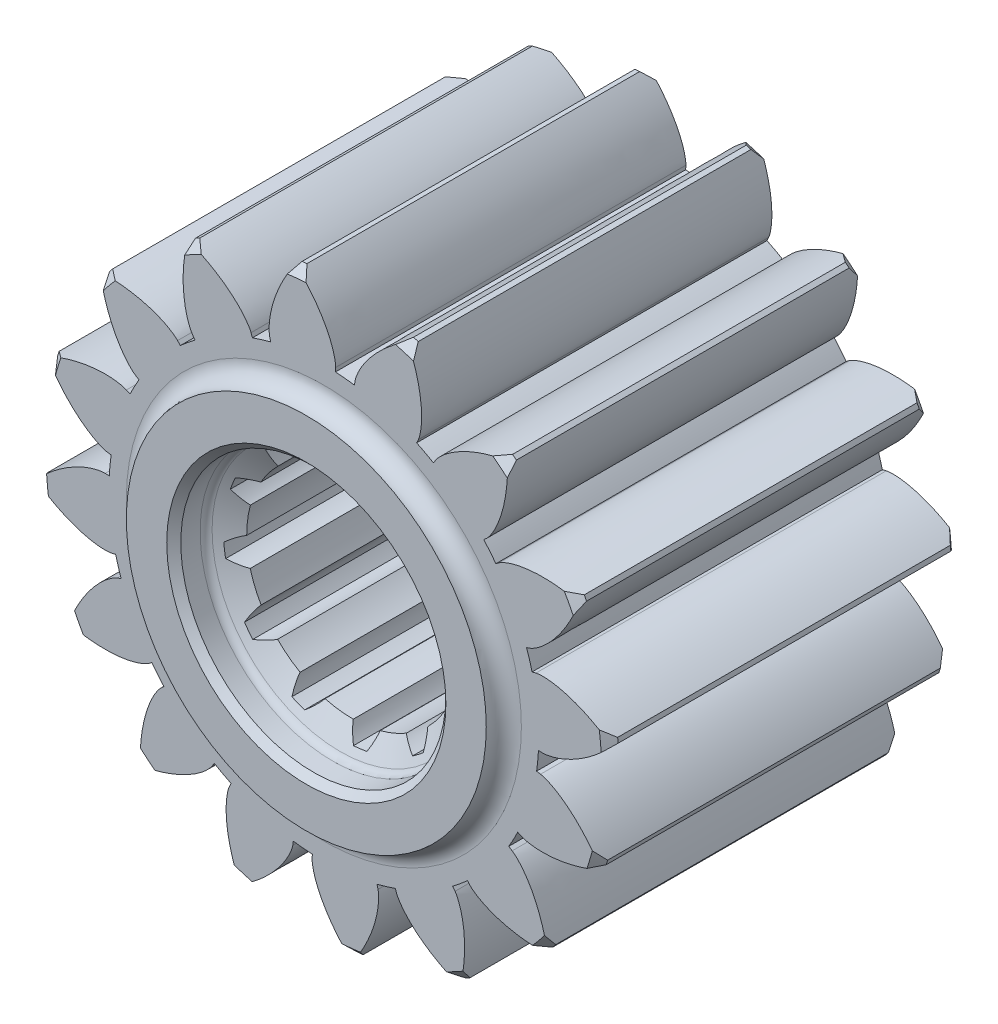
from build123d import *

# Parameters (mm, degrees)
CUT_EXTRUDE1_DEPTH = 64.71228296
CUT_EXTRUDE2_DEPTH = 64.71228296


with BuildPart() as part:
    # Sketch1 → Revolve1 (revolve)
    with BuildSketch(Plane(origin=(0, 0, 0), x_dir=(0, 0, -1), z_dir=(1, 0, 0)), mode=Mode.PRIVATE) as revolve1_sk:
        with BuildLine():
            Line((0, 15.9), (0, 20.5))
            ThreePointArc((0, 20.5), (1.414213562, 21.085786438), (2, 22.5))
            Line((2, 22.5), (2, 31.65))
            Line((2, 31.65), (3, 32.65))
            Line((3, 32.65), (40.9, 32.65))
            Line((40.9, 32.65), (41.9, 31.65))
            Line((41.9, 31.65), (41.9, 22.5))
            ThreePointArc((41.9, 22.5), (42.485786438, 21.085786438), (43.9, 20.5))
            Line((43.9, 20.5), (43.9, 15.9))
            Line((43.9, 15.9), (43.1, 15.1))
            Line((43.1, 15.1), (40.9, 15.1))
            ThreePointArc((40.9, 15.1), (40.4, 14.966025404), (40.033974596, 14.6))
            Line((40.033974596, 14.6), (38.590598923, 12.1))
            Line((38.590598923, 12.1), (5.309401077, 12.1))
            Line((5.309401077, 12.1), (3.866025404, 14.6))
            ThreePointArc((3.866025404, 14.6), (3.5, 14.966025404), (3, 15.1))
            Line((3, 15.1), (0.8, 15.1))
            Line((0.8, 15.1), (0, 15.9))
        make_face()
    revolve(revolve1_sk.sketch.rotate(Axis((0, 0, 0), (0, 0, -1)), 90), axis=Axis((0, 0, 0), (0, 0, -1)))

    # Sketch2 → Cut-Extrude1 (cut, through all)
    with BuildSketch(Plane.XY):
        with BuildLine():
            add(Edge.make_bspline(
                [(-6, 10.392304845), (-6.083308328, 10.463331779), (-6.269176039, 10.613754424), (-6.594236465, 10.826695887), (-6.98399774, 11.047629995), (-7.379208652, 11.234273746), (-7.646059201, 11.341671616), (-7.756770639, 11.3834588)],
                knots=[0.250164539, 0.250164539, 0.250164539, 0.250164539, 0.360157942, 0.490164615, 0.640140514, 0.810085642, 0.928974744, 0.928974744, 0.928974744, 0.928974744], degree=3))
            ThreePointArc((-7.756770639, 11.3834588), (-8.384963449, 10.928998717), (-8.98659136, 10.439913828))
            add(Edge.make_bspline(
                [(-8.484155123, 8.486407476), (-8.531186971, 8.585266508), (-8.628348989, 8.803746073), (-8.74985383, 9.172859769), (-8.862324593, 9.606537136), (-8.940263424, 10.036598869), (-8.974897897, 10.322157919), (-8.98659136, 10.439913828)],
                knots=[0.250164539, 0.250164539, 0.250164539, 0.250164539, 0.360157942, 0.490164615, 0.640140514, 0.810085642, 0.928974744, 0.928974744, 0.928974744, 0.928974744], degree=3))
            ThreePointArc((-8.484155123, 8.486407476), (-7.304505363, 9.520724836), (-6, 10.392304845))
        make_face()
        with BuildLine():
            add(Edge.make_bspline(
                [(-10.392304845, 6), (-10.499965441, 6.019856965), (-10.736142923, 6.057192941), (-11.124124241, 6.079075445), (-11.57213446, 6.075529357), (-12.007719026, 6.039562131), (-12.292517315, 5.99914614), (-12.409289825, 5.979979185)],
                knots=[0.250164539, 0.250164539, 0.250164539, 0.250164539, 0.360157942, 0.490164615, 0.640140514, 0.810085642, 0.928974744, 0.928974744, 0.928974744, 0.928974744], degree=3))
            ThreePointArc((-12.409289825, 5.979979185), (-12.726090715, 5.272308803), (-13.002573325, 4.547934908))
            add(Edge.make_bspline(
                [(-11.590697604, 3.107366899), (-11.680857895, 3.169465408), (-11.874242454, 3.310093253), (-12.164025581, 3.56900267), (-12.478266802, 3.888342906), (-12.760794676, 4.221817876), (-12.933568534, 4.451802031), (-13.002573325, 4.547934908)],
                knots=[0.250164539, 0.250164539, 0.250164539, 0.250164539, 0.360157942, 0.490164615, 0.640140514, 0.810085642, 0.928974744, 0.928974744, 0.928974744, 0.928974744], degree=3))
            ThreePointArc((-11.590697604, 3.107366899), (-11.086249625, 4.592936888), (-10.392304845, 6))
        make_face()
        with BuildLine():
            ThreePointArc((-13.736749823, -1.025831024), (-13.657272252, -1.797091997), (-13.534526268, -2.562659497))
            add(Edge.make_bspline(
                [(-11.591522022, -3.104290129), (-11.700652379, -3.095591387), (-11.938442242, -3.070496381), (-12.3188565, -2.991165812), (-12.750667499, -2.871729666), (-13.1620813, -2.724195808), (-13.426699928, -2.611410616), (-13.534526268, -2.562659497)],
                knots=[0.250164539, 0.250164539, 0.250164539, 0.250164539, 0.360157942, 0.490164615, 0.640140514, 0.810085642, 0.928974744, 0.928974744, 0.928974744, 0.928974744], degree=3))
            ThreePointArc((-11.591522022, -3.104290129), (-11.897442252, -1.565524789), (-12, 0))
            add(Edge.make_bspline(
                [(-12, 0), (-12.103165293, -0.036633662), (-12.326368981, -0.122388499), (-12.67331191, -0.297428354), (-13.059527097, -0.524504465), (-13.418770784, -0.77344528), (-13.645205342, -0.950845699), (-13.736749823, -1.025831024)],
                knots=[0.250164539, 0.250164539, 0.250164539, 0.250164539, 0.360157942, 0.490164615, 0.640140514, 0.810085642, 0.928974744, 0.928974744, 0.928974744, 0.928974744], degree=3))
        make_face()
        with BuildLine():
            ThreePointArc((-11.3834588, -7.756770639), (-10.928998717, -8.384963449), (-10.439913828, -8.98659136))
            add(Edge.make_bspline(
                [(-8.486407476, -8.484155123), (-8.585266508, -8.531186971), (-8.803746073, -8.628348989), (-9.172859769, -8.74985383), (-9.606537136, -8.862324593), (-10.036598869, -8.940263424), (-10.322157919, -8.974897897), (-10.439913828, -8.98659136)],
                knots=[0.250164539, 0.250164539, 0.250164539, 0.250164539, 0.360157942, 0.490164615, 0.640140514, 0.810085642, 0.928974744, 0.928974744, 0.928974744, 0.928974744], degree=3))
            ThreePointArc((-8.486407476, -8.484155123), (-9.520724836, -7.304505363), (-10.392304845, -6))
            add(Edge.make_bspline(
                [(-10.392304845, -6), (-10.463331779, -6.083308328), (-10.613754424, -6.269176039), (-10.826695887, -6.594236465), (-11.047629995, -6.98399774), (-11.234273746, -7.379208652), (-11.341671616, -7.646059201), (-11.3834588, -7.756770639)],
                knots=[0.250164539, 0.250164539, 0.250164539, 0.250164539, 0.360157942, 0.490164615, 0.640140514, 0.810085642, 0.928974744, 0.928974744, 0.928974744, 0.928974744], degree=3))
        make_face()
        with BuildLine():
            ThreePointArc((-5.979979185, -12.409289825), (-5.272308803, -12.726090715), (-4.547934908, -13.002573325))
            add(Edge.make_bspline(
                [(-3.107366899, -11.590697604), (-3.169465408, -11.680857895), (-3.310093253, -11.874242454), (-3.56900267, -12.164025581), (-3.888342906, -12.478266802), (-4.221817876, -12.760794676), (-4.451802031, -12.933568534), (-4.547934908, -13.002573325)],
                knots=[0.250164539, 0.250164539, 0.250164539, 0.250164539, 0.360157942, 0.490164615, 0.640140514, 0.810085642, 0.928974744, 0.928974744, 0.928974744, 0.928974744], degree=3))
            ThreePointArc((-3.107366899, -11.590697604), (-4.592936888, -11.086249625), (-6, -10.392304845))
            add(Edge.make_bspline(
                [(-6, -10.392304845), (-6.019856965, -10.499965441), (-6.057192941, -10.736142923), (-6.079075445, -11.124124241), (-6.075529357, -11.57213446), (-6.039562131, -12.007719026), (-5.99914614, -12.292517315), (-5.979979185, -12.409289825)],
                knots=[0.250164539, 0.250164539, 0.250164539, 0.250164539, 0.360157942, 0.490164615, 0.640140514, 0.810085642, 0.928974744, 0.928974744, 0.928974744, 0.928974744], degree=3))
        make_face()
        with BuildLine():
            ThreePointArc((1.025831024, -13.736749823), (1.797091997, -13.657272252), (2.562659497, -13.534526268))
            add(Edge.make_bspline(
                [(3.104290129, -11.591522022), (3.095591387, -11.700652379), (3.070496381, -11.938442242), (2.991165812, -12.3188565), (2.871729666, -12.750667499), (2.724195808, -13.1620813), (2.611410616, -13.426699928), (2.562659497, -13.534526268)],
                knots=[0.250164539, 0.250164539, 0.250164539, 0.250164539, 0.360157942, 0.490164615, 0.640140514, 0.810085642, 0.928974744, 0.928974744, 0.928974744, 0.928974744], degree=3))
            ThreePointArc((3.104290129, -11.591522022), (1.565524789, -11.897442252), (0, -12))
            add(Edge.make_bspline(
                [(0, -12), (0.036633662, -12.103165293), (0.122388499, -12.326368981), (0.297428354, -12.67331191), (0.524504465, -13.059527097), (0.77344528, -13.418770784), (0.950845699, -13.645205342), (1.025831024, -13.736749823)],
                knots=[0.250164539, 0.250164539, 0.250164539, 0.250164539, 0.360157942, 0.490164615, 0.640140514, 0.810085642, 0.928974744, 0.928974744, 0.928974744, 0.928974744], degree=3))
        make_face()
        with BuildLine():
            ThreePointArc((7.756770639, -11.3834588), (8.384963449, -10.928998717), (8.98659136, -10.439913828))
            add(Edge.make_bspline(
                [(8.484155123, -8.486407476), (8.531186971, -8.585266508), (8.628348989, -8.803746073), (8.74985383, -9.172859769), (8.862324593, -9.606537136), (8.940263424, -10.036598869), (8.974897897, -10.322157919), (8.98659136, -10.439913828)],
                knots=[0.250164539, 0.250164539, 0.250164539, 0.250164539, 0.360157942, 0.490164615, 0.640140514, 0.810085642, 0.928974744, 0.928974744, 0.928974744, 0.928974744], degree=3))
            ThreePointArc((8.484155123, -8.486407476), (7.304505363, -9.520724836), (6, -10.392304845))
            add(Edge.make_bspline(
                [(6, -10.392304845), (6.083308328, -10.463331779), (6.269176039, -10.613754424), (6.594236465, -10.826695887), (6.98399774, -11.047629995), (7.379208652, -11.234273746), (7.646059201, -11.341671616), (7.756770639, -11.3834588)],
                knots=[0.250164539, 0.250164539, 0.250164539, 0.250164539, 0.360157942, 0.490164615, 0.640140514, 0.810085642, 0.928974744, 0.928974744, 0.928974744, 0.928974744], degree=3))
        make_face()
        with BuildLine():
            ThreePointArc((12.409289825, -5.979979185), (12.726090715, -5.272308803), (13.002573325, -4.547934908))
            add(Edge.make_bspline(
                [(11.590697604, -3.107366899), (11.680857895, -3.169465408), (11.874242454, -3.310093253), (12.164025581, -3.56900267), (12.478266802, -3.888342906), (12.760794676, -4.221817876), (12.933568534, -4.451802031), (13.002573325, -4.547934908)],
                knots=[0.250164539, 0.250164539, 0.250164539, 0.250164539, 0.360157942, 0.490164615, 0.640140514, 0.810085642, 0.928974744, 0.928974744, 0.928974744, 0.928974744], degree=3))
            ThreePointArc((11.590697604, -3.107366899), (11.086249625, -4.592936888), (10.392304845, -6))
            add(Edge.make_bspline(
                [(10.392304845, -6), (10.499965441, -6.019856965), (10.736142923, -6.057192941), (11.124124241, -6.079075445), (11.57213446, -6.075529357), (12.007719026, -6.039562131), (12.292517315, -5.99914614), (12.409289825, -5.979979185)],
                knots=[0.250164539, 0.250164539, 0.250164539, 0.250164539, 0.360157942, 0.490164615, 0.640140514, 0.810085642, 0.928974744, 0.928974744, 0.928974744, 0.928974744], degree=3))
        make_face()
        with BuildLine():
            add(Edge.make_bspline(
                [(12, 0), (12.103165293, 0.036633662), (12.326368981, 0.122388499), (12.67331191, 0.297428354), (13.059527097, 0.524504465), (13.418770784, 0.77344528), (13.645205342, 0.950845699), (13.736749823, 1.025831024)],
                knots=[0.250164539, 0.250164539, 0.250164539, 0.250164539, 0.360157942, 0.490164615, 0.640140514, 0.810085642, 0.928974744, 0.928974744, 0.928974744, 0.928974744], degree=3))
            ThreePointArc((13.736749823, 1.025831024), (13.657272252, 1.797091997), (13.534526268, 2.562659497))
            add(Edge.make_bspline(
                [(11.591522022, 3.104290129), (11.700652379, 3.095591387), (11.938442242, 3.070496381), (12.3188565, 2.991165812), (12.750667499, 2.871729666), (13.1620813, 2.724195808), (13.426699928, 2.611410616), (13.534526268, 2.562659497)],
                knots=[0.250164539, 0.250164539, 0.250164539, 0.250164539, 0.360157942, 0.490164615, 0.640140514, 0.810085642, 0.928974744, 0.928974744, 0.928974744, 0.928974744], degree=3))
            ThreePointArc((11.591522022, 3.104290129), (11.897442252, 1.565524789), (12, 0))
        make_face()
        with BuildLine():
            add(Edge.make_bspline(
                [(10.392304845, 6), (10.463331779, 6.083308328), (10.613754424, 6.269176039), (10.826695887, 6.594236465), (11.047629995, 6.98399774), (11.234273746, 7.379208652), (11.341671616, 7.646059201), (11.3834588, 7.756770639)],
                knots=[0.250164539, 0.250164539, 0.250164539, 0.250164539, 0.360157942, 0.490164615, 0.640140514, 0.810085642, 0.928974744, 0.928974744, 0.928974744, 0.928974744], degree=3))
            ThreePointArc((11.3834588, 7.756770639), (10.928998717, 8.384963449), (10.439913828, 8.98659136))
            add(Edge.make_bspline(
                [(8.486407476, 8.484155123), (8.585266508, 8.531186971), (8.803746073, 8.628348989), (9.172859769, 8.74985383), (9.606537136, 8.862324593), (10.036598869, 8.940263424), (10.322157919, 8.974897897), (10.439913828, 8.98659136)],
                knots=[0.250164539, 0.250164539, 0.250164539, 0.250164539, 0.360157942, 0.490164615, 0.640140514, 0.810085642, 0.928974744, 0.928974744, 0.928974744, 0.928974744], degree=3))
            ThreePointArc((8.486407476, 8.484155123), (9.520724836, 7.304505363), (10.392304845, 6))
        make_face()
        with BuildLine():
            add(Edge.make_bspline(
                [(6, 10.392304845), (6.019856965, 10.499965441), (6.057192941, 10.736142923), (6.079075445, 11.124124241), (6.075529357, 11.57213446), (6.039562131, 12.007719026), (5.99914614, 12.292517315), (5.979979185, 12.409289825)],
                knots=[0.250164539, 0.250164539, 0.250164539, 0.250164539, 0.360157942, 0.490164615, 0.640140514, 0.810085642, 0.928974744, 0.928974744, 0.928974744, 0.928974744], degree=3))
            ThreePointArc((5.979979185, 12.409289825), (5.272308803, 12.726090715), (4.547934908, 13.002573325))
            add(Edge.make_bspline(
                [(3.107366899, 11.590697604), (3.169465408, 11.680857895), (3.310093253, 11.874242454), (3.56900267, 12.164025581), (3.888342906, 12.478266802), (4.221817876, 12.760794676), (4.451802031, 12.933568534), (4.547934908, 13.002573325)],
                knots=[0.250164539, 0.250164539, 0.250164539, 0.250164539, 0.360157942, 0.490164615, 0.640140514, 0.810085642, 0.928974744, 0.928974744, 0.928974744, 0.928974744], degree=3))
            ThreePointArc((3.107366899, 11.590697604), (4.592936888, 11.086249625), (6, 10.392304845))
        make_face()
        with BuildLine():
            add(Edge.make_bspline(
                [(0, 12), (-0.036633662, 12.103165293), (-0.122388499, 12.326368981), (-0.297428354, 12.67331191), (-0.524504465, 13.059527097), (-0.77344528, 13.418770784), (-0.950845699, 13.645205342), (-1.025831024, 13.736749823)],
                knots=[0.250164539, 0.250164539, 0.250164539, 0.250164539, 0.360157942, 0.490164615, 0.640140514, 0.810085642, 0.928974744, 0.928974744, 0.928974744, 0.928974744], degree=3))
            ThreePointArc((-1.025831024, 13.736749823), (-1.797091997, 13.657272252), (-2.562659497, 13.534526268))
            add(Edge.make_bspline(
                [(-3.104290129, 11.591522022), (-3.095591387, 11.700652379), (-3.070496381, 11.938442242), (-2.991165812, 12.3188565), (-2.871729666, 12.750667499), (-2.724195808, 13.1620813), (-2.611410616, 13.426699928), (-2.562659497, 13.534526268)],
                knots=[0.250164539, 0.250164539, 0.250164539, 0.250164539, 0.360157942, 0.490164615, 0.640140514, 0.810085642, 0.928974744, 0.928974744, 0.928974744, 0.928974744], degree=3))
            ThreePointArc((-3.104290129, 11.591522022), (-1.565524789, 11.897442252), (0, 12))
        make_face()
    extrude(amount=-CUT_EXTRUDE1_DEPTH, mode=Mode.SUBTRACT)

    # Sketch5 → Cut-Extrude2 (cut, through all)
    with BuildSketch(Plane.XY):
        with BuildLine():
            Line((1.339999101, 24.905509479), (1.31520303, 24.444644423))
            ThreePointArc((1.31520303, 24.444644423), (2.400672105, 24.362002657), (3.481393789, 24.231184397))
            Line((3.481393789, 24.231184397), (3.547029955, 24.688025002))
            add(Edge.make_bspline(
                [(3.547029955, 24.688025002), (3.588191523, 24.90604716), (3.748651512, 25.380269208), (4.127077833, 26.183224485), (4.742029159, 27.174027421), (5.670941576, 28.350245), (6.963369279, 29.648823759), (8.201436826, 30.636066291), (9.002466904, 31.185498674), (9.211702648, 31.323585911)],
                knots=[0, 0, 0, 0, 0.040002312, 0.090002485, 0.160002473, 0.250002323, 0.360002057, 0.490001686, 0.535233344, 0.535233344, 0.535233344, 0.535233344], degree=3))
            ThreePointArc((9.211702648, 31.323585911), (3.201876771, 32.492622011), (-2.920537009, 32.519116894))
            add(Edge.make_bspline(
                [(1.339999101, 24.905509479), (1.342184538, 25.127372409), (1.277373288, 25.623793059), (1.062952868, 26.485168436), (0.653222397, 27.576945213), (-0.028239685, 28.911851767), (-1.042341735, 30.437719771), (-2.063898237, 31.647629479), (-2.742278678, 32.342845352), (-2.920537009, 32.519116894)],
                knots=[0, 0, 0, 0, 0.040002312, 0.090002485, 0.160002473, 0.250002323, 0.360002057, 0.490001686, 0.535233348, 0.535233348, 0.535233348, 0.535233348], degree=3))
        make_face()
        with BuildLine():
            ThreePointArc((-8.13947127, 23.087213072), (-7.105002973, 23.426253067), (-6.056484349, 23.718967038))
            Line((-6.056484349, 23.718967038), (-6.170669769, 24.166150595))
            add(Edge.make_bspline(
                [(-6.170669769, 24.166150595), (-6.216074907, 24.383328655), (-6.249306128, 24.882858078), (-6.206963477, 25.769509508), (-6.017986402, 26.920223745), (-5.609902213, 28.362386484), (-4.912799287, 30.056707491), (-4.146775381, 31.442588598), (-3.616978758, 32.256738871), (-3.476513835, 32.464385895)],
                knots=[0, 0, 0, 0, 0.040002312, 0.090002485, 0.160002473, 0.250002323, 0.360002057, 0.490001686, 0.535233344, 0.535233344, 0.535233344, 0.535233344], degree=3))
            ThreePointArc((-3.476513835, 32.464385895), (-9.476239704, 31.244573626), (-15.142751638, 28.926105387))
            add(Edge.make_bspline(
                [(-8.29292811, 23.52248591), (-8.375812296, 23.728296861), (-8.625662041, 24.162127547), (-9.153394766, 24.875879485), (-9.949741246, 25.72775264), (-11.090176737, 26.700261235), (-12.611009271, 27.7218994), (-14.017816814, 28.448777466), (-14.910606215, 28.831468227), (-15.142751638, 28.926105387)],
                knots=[0, 0, 0, 0, 0.040002312, 0.090002485, 0.160002473, 0.250002323, 0.360002057, 0.490001686, 0.535233348, 0.535233348, 0.535233348, 0.535233348], degree=3))
            Line((-8.29292811, 23.52248591), (-8.13947127, 23.087213072))
        make_face()
        with BuildLine():
            ThreePointArc((-16.354984854, 18.214962817), (-15.529005757, 18.924068807), (-14.672317647, 19.59575196))
            Line((-14.672317647, 19.59575196), (-14.948940959, 19.965198827))
            add(Edge.make_bspline(
                [(-14.948940959, 19.965198827), (-15.074000281, 20.148469397), (-15.295863561, 20.59725737), (-15.596050865, 21.432620309), (-15.861818086, 22.568060037), (-16.036689244, 24.056611731), (-16.041038697, 25.888729972), (-15.863678628, 27.462261819), (-15.685772192, 28.417182983), (-15.6354626, 28.662777417)],
                knots=[0, 0, 0, 0, 0.040002312, 0.090002485, 0.160002473, 0.250002323, 0.360002057, 0.490001686, 0.535233344, 0.535233344, 0.535233344, 0.535233344], degree=3))
            ThreePointArc((-15.6354626, 28.662777417), (-20.711684585, 25.23982214), (-25.059619598, 20.92935655))
            add(Edge.make_bspline(
                [(-16.663332191, 18.558377092), (-16.818667635, 18.716803212), (-17.215518517, 19.021997146), (-17.976221021, 19.479463383), (-19.037946978, 19.961742951), (-20.463734914, 20.423797968), (-22.259764964, 20.785671145), (-23.837649852, 20.918856974), (-24.80892912, 20.930761422), (-25.059619598, 20.92935655)],
                knots=[0, 0, 0, 0, 0.040002312, 0.090002485, 0.160002473, 0.250002323, 0.360002057, 0.490001686, 0.535233348, 0.535233348, 0.535233348, 0.535233348], degree=3))
            Line((-16.663332191, 18.558377092), (-16.354984854, 18.214962817))
        make_face()
        with BuildLine():
            ThreePointArc((-22.080600252, 10.569649592), (-21.588858184, 11.540866618), (-21.054423588, 12.489261282))
            Line((-21.054423588, 12.489261282), (-21.451371399, 12.724726523))
            add(Edge.make_bspline(
                [(-21.451371399, 12.724726523), (-21.637045759, 12.846188321), (-22.013764423, 13.175910942), (-22.610780886, 13.832808956), (-23.290831755, 14.780113767), (-24.02203571, 16.088435917), (-24.727175378, 17.779427996), (-25.165480608, 19.301054623), (-25.366549002, 20.251368588), (-25.414053921, 20.497520906)],
                knots=[0, 0, 0, 0, 0.040002312, 0.090002485, 0.160002473, 0.250002323, 0.360002057, 0.490001686, 0.535233344, 0.535233344, 0.535233344, 0.535233344], degree=3))
            ThreePointArc((-25.414053921, 20.497520906), (-28.793963241, 15.392536532), (-31.161387641, 9.746302904))
            add(Edge.make_bspline(
                [(-22.496894999, 10.768923595), (-22.701033289, 10.855845943), (-23.184468358, 10.985940114), (-24.062330582, 11.117475562), (-25.227797863, 11.156738851), (-26.721874954, 11.037996603), (-28.519673226, 10.68501288), (-30.02841679, 10.204230137), (-30.930317461, 9.843535929), (-31.161387641, 9.746302904)],
                knots=[0, 0, 0, 0, 0.040002312, 0.090002485, 0.160002473, 0.250002323, 0.360002057, 0.490001686, 0.535233348, 0.535233348, 0.535233348, 0.535233348], degree=3))
            Line((-22.496894999, 10.768923595), (-22.080600252, 10.569649592))
        make_face()
        with BuildLine():
            ThreePointArc((-24.444644423, 1.31520303), (-24.362002657, 2.400672105), (-24.231184397, 3.481393789))
            Line((-24.231184397, 3.481393789), (-24.688025002, 3.547029955))
            add(Edge.make_bspline(
                [(-24.688025002, 3.547029955), (-24.90604716, 3.588191523), (-25.380269208, 3.748651512), (-26.183224485, 4.127077833), (-27.174027421, 4.742029159), (-28.350245, 5.670941576), (-29.648823759, 6.963369279), (-30.636066291, 8.201436826), (-31.185498674, 9.002466904), (-31.323585911, 9.211702648)],
                knots=[0, 0, 0, 0, 0.040002312, 0.090002485, 0.160002473, 0.250002323, 0.360002057, 0.490001686, 0.535233344, 0.535233344, 0.535233344, 0.535233344], degree=3))
            ThreePointArc((-31.323585911, 9.211702648), (-32.492622011, 3.201876771), (-32.519116894, -2.920537009))
            add(Edge.make_bspline(
                [(-24.905509479, 1.339999101), (-25.127372409, 1.342184538), (-25.623793059, 1.277373288), (-26.485168436, 1.062952868), (-27.576945213, 0.653222397), (-28.911851767, -0.028239685), (-30.437719771, -1.042341735), (-31.647629479, -2.063898237), (-32.342845352, -2.742278678), (-32.519116894, -2.920537009)],
                knots=[0, 0, 0, 0, 0.040002312, 0.090002485, 0.160002473, 0.250002323, 0.360002057, 0.490001686, 0.535233348, 0.535233348, 0.535233348, 0.535233348], degree=3))
            Line((-24.905509479, 1.339999101), (-24.444644423, 1.31520303))
        make_face()
        with BuildLine():
            ThreePointArc((-23.087213072, -8.13947127), (-23.426253067, -7.105002973), (-23.718967038, -6.056484349))
            Line((-23.718967038, -6.056484349), (-24.166150595, -6.170669769))
            add(Edge.make_bspline(
                [(-24.166150595, -6.170669769), (-24.383328655, -6.216074907), (-24.882858078, -6.249306128), (-25.769509508, -6.206963477), (-26.920223745, -6.017986402), (-28.362386484, -5.609902213), (-30.056707491, -4.912799287), (-31.442588598, -4.146775381), (-32.256738871, -3.616978758), (-32.464385895, -3.476513835)],
                knots=[0, 0, 0, 0, 0.040002312, 0.090002485, 0.160002473, 0.250002323, 0.360002057, 0.490001686, 0.535233344, 0.535233344, 0.535233344, 0.535233344], degree=3))
            ThreePointArc((-32.464385895, -3.476513835), (-31.244573626, -9.476239704), (-28.926105387, -15.142751638))
            add(Edge.make_bspline(
                [(-23.52248591, -8.29292811), (-23.728296861, -8.375812296), (-24.162127547, -8.625662041), (-24.875879485, -9.153394766), (-25.72775264, -9.949741246), (-26.700261235, -11.090176737), (-27.7218994, -12.611009271), (-28.448777466, -14.017816814), (-28.831468227, -14.910606215), (-28.926105387, -15.142751638)],
                knots=[0, 0, 0, 0, 0.040002312, 0.090002485, 0.160002473, 0.250002323, 0.360002057, 0.490001686, 0.535233348, 0.535233348, 0.535233348, 0.535233348], degree=3))
            Line((-23.52248591, -8.29292811), (-23.087213072, -8.13947127))
        make_face()
        with BuildLine():
            ThreePointArc((-18.214962817, -16.354984854), (-18.924068807, -15.529005757), (-19.59575196, -14.672317647))
            Line((-19.59575196, -14.672317647), (-19.965198827, -14.948940959))
            add(Edge.make_bspline(
                [(-19.965198827, -14.948940959), (-20.148469397, -15.074000281), (-20.59725737, -15.295863561), (-21.43262031, -15.596050864), (-22.568060037, -15.861818086), (-24.056611731, -16.036689244), (-25.888729972, -16.041038697), (-27.462261819, -15.863678628), (-28.417182983, -15.685772192), (-28.662777417, -15.6354626)],
                knots=[0, 0, 0, 0, 0.040002312, 0.090002485, 0.160002473, 0.250002323, 0.360002057, 0.490001686, 0.535233344, 0.535233344, 0.535233344, 0.535233344], degree=3))
            ThreePointArc((-28.662777417, -15.6354626), (-25.23982214, -20.711684585), (-20.92935655, -25.059619598))
            add(Edge.make_bspline(
                [(-18.558377092, -16.663332191), (-18.716803212, -16.818667635), (-19.021997146, -17.215518517), (-19.479463383, -17.976221021), (-19.961742951, -19.037946978), (-20.423797968, -20.463734914), (-20.785671145, -22.259764964), (-20.918856974, -23.837649852), (-20.930761422, -24.80892912), (-20.92935655, -25.059619598)],
                knots=[0, 0, 0, 0, 0.040002312, 0.090002485, 0.160002473, 0.250002323, 0.360002057, 0.490001686, 0.535233348, 0.535233348, 0.535233348, 0.535233348], degree=3))
            Line((-18.558377092, -16.663332191), (-18.214962817, -16.354984854))
        make_face()
        with BuildLine():
            ThreePointArc((-10.569649592, -22.080600252), (-11.540866618, -21.588858184), (-12.489261282, -21.054423588))
            Line((-12.489261282, -21.054423588), (-12.724726523, -21.451371399))
            add(Edge.make_bspline(
                [(-12.724726523, -21.451371399), (-12.846188321, -21.637045759), (-13.175910942, -22.013764423), (-13.832808956, -22.610780886), (-14.780113767, -23.290831755), (-16.088435917, -24.02203571), (-17.779427996, -24.727175378), (-19.301054623, -25.165480608), (-20.251368588, -25.366549002), (-20.497520906, -25.414053921)],
                knots=[0, 0, 0, 0, 0.040002312, 0.090002485, 0.160002473, 0.250002323, 0.360002057, 0.490001686, 0.535233344, 0.535233344, 0.535233344, 0.535233344], degree=3))
            ThreePointArc((-20.497520906, -25.414053921), (-15.392536532, -28.793963241), (-9.746302904, -31.161387641))
            add(Edge.make_bspline(
                [(-10.768923595, -22.496894999), (-10.855845943, -22.701033289), (-10.985940114, -23.184468358), (-11.117475562, -24.062330582), (-11.156738851, -25.227797863), (-11.037996603, -26.721874954), (-10.68501288, -28.519673226), (-10.204230137, -30.02841679), (-9.843535929, -30.930317461), (-9.746302904, -31.161387641)],
                knots=[0, 0, 0, 0, 0.040002312, 0.090002485, 0.160002473, 0.250002323, 0.360002057, 0.490001686, 0.535233348, 0.535233348, 0.535233348, 0.535233348], degree=3))
            Line((-10.768923595, -22.496894999), (-10.569649592, -22.080600252))
        make_face()
        with BuildLine():
            ThreePointArc((-1.31520303, -24.444644423), (-2.400672105, -24.362002657), (-3.481393789, -24.231184397))
            Line((-3.481393789, -24.231184397), (-3.547029955, -24.688025002))
            add(Edge.make_bspline(
                [(-3.547029955, -24.688025002), (-3.588191523, -24.90604716), (-3.748651512, -25.380269208), (-4.127077833, -26.183224485), (-4.742029159, -27.174027421), (-5.670941576, -28.350245), (-6.963369279, -29.648823759), (-8.201436826, -30.636066291), (-9.002466904, -31.185498674), (-9.211702648, -31.323585911)],
                knots=[0, 0, 0, 0, 0.040002312, 0.090002485, 0.160002473, 0.250002323, 0.360002057, 0.490001686, 0.535233344, 0.535233344, 0.535233344, 0.535233344], degree=3))
            ThreePointArc((-9.211702648, -31.323585911), (-3.201876771, -32.492622011), (2.920537009, -32.519116894))
            add(Edge.make_bspline(
                [(-1.339999101, -24.905509479), (-1.342184538, -25.127372409), (-1.277373288, -25.623793059), (-1.062952868, -26.485168436), (-0.653222397, -27.576945213), (0.028239685, -28.911851767), (1.042341735, -30.437719771), (2.063898237, -31.647629479), (2.742278678, -32.342845352), (2.920537009, -32.519116894)],
                knots=[0, 0, 0, 0, 0.040002312, 0.090002485, 0.160002473, 0.250002323, 0.360002057, 0.490001686, 0.535233348, 0.535233348, 0.535233348, 0.535233348], degree=3))
            Line((-1.339999101, -24.905509479), (-1.31520303, -24.444644423))
        make_face()
        with BuildLine():
            Line((8.29292811, -23.52248591), (8.13947127, -23.087213072))
            ThreePointArc((8.13947127, -23.087213072), (7.105002973, -23.426253067), (6.056484349, -23.718967038))
            Line((6.056484349, -23.718967038), (6.170669769, -24.166150595))
            add(Edge.make_bspline(
                [(6.170669769, -24.166150595), (6.216074907, -24.383328655), (6.249306128, -24.882858078), (6.206963477, -25.769509508), (6.017986402, -26.920223745), (5.609902213, -28.362386484), (4.912799287, -30.056707491), (4.146775381, -31.442588598), (3.616978758, -32.256738871), (3.476513835, -32.464385895)],
                knots=[0, 0, 0, 0, 0.040002312, 0.090002485, 0.160002473, 0.250002323, 0.360002057, 0.490001686, 0.535233344, 0.535233344, 0.535233344, 0.535233344], degree=3))
            ThreePointArc((3.476513835, -32.464385895), (9.476239704, -31.244573626), (15.142751638, -28.926105387))
            add(Edge.make_bspline(
                [(8.29292811, -23.52248591), (8.375812296, -23.728296861), (8.625662041, -24.162127547), (9.153394766, -24.875879485), (9.949741246, -25.72775264), (11.090176737, -26.700261235), (12.611009271, -27.7218994), (14.017816814, -28.448777466), (14.910606215, -28.831468227), (15.142751638, -28.926105387)],
                knots=[0, 0, 0, 0, 0.040002312, 0.090002485, 0.160002473, 0.250002323, 0.360002057, 0.490001686, 0.535233348, 0.535233348, 0.535233348, 0.535233348], degree=3))
        make_face()
        with BuildLine():
            Line((16.663332191, -18.558377092), (16.354984854, -18.214962817))
            ThreePointArc((16.354984854, -18.214962817), (15.529005757, -18.924068807), (14.672317647, -19.59575196))
            Line((14.672317647, -19.59575196), (14.948940959, -19.965198827))
            add(Edge.make_bspline(
                [(14.948940959, -19.965198827), (15.074000281, -20.148469397), (15.295863561, -20.59725737), (15.596050864, -21.432620309), (15.861818086, -22.568060037), (16.036689244, -24.056611731), (16.041038697, -25.888729972), (15.863678628, -27.462261819), (15.685772192, -28.417182983), (15.6354626, -28.662777417)],
                knots=[0, 0, 0, 0, 0.040002312, 0.090002485, 0.160002473, 0.250002323, 0.360002057, 0.490001686, 0.535233344, 0.535233344, 0.535233344, 0.535233344], degree=3))
            ThreePointArc((15.6354626, -28.662777417), (20.711684585, -25.23982214), (25.059619598, -20.92935655))
            add(Edge.make_bspline(
                [(16.663332191, -18.558377092), (16.818667635, -18.716803212), (17.215518517, -19.021997146), (17.976221021, -19.479463383), (19.037946978, -19.961742951), (20.463734914, -20.423797968), (22.259764964, -20.785671145), (23.837649852, -20.918856974), (24.80892912, -20.930761422), (25.059619598, -20.92935655)],
                knots=[0, 0, 0, 0, 0.040002312, 0.090002485, 0.160002473, 0.250002323, 0.360002057, 0.490001686, 0.535233348, 0.535233348, 0.535233348, 0.535233348], degree=3))
        make_face()
        with BuildLine():
            Line((22.496894999, -10.768923595), (22.080600252, -10.569649592))
            ThreePointArc((22.080600252, -10.569649592), (21.588858184, -11.540866618), (21.054423588, -12.489261282))
            Line((21.054423588, -12.489261282), (21.451371399, -12.724726523))
            add(Edge.make_bspline(
                [(21.451371399, -12.724726523), (21.637045759, -12.846188321), (22.013764423, -13.175910942), (22.610780886, -13.832808956), (23.290831755, -14.780113767), (24.02203571, -16.088435917), (24.727175378, -17.779427996), (25.165480608, -19.301054623), (25.366549002, -20.251368588), (25.414053921, -20.497520906)],
                knots=[0, 0, 0, 0, 0.040002312, 0.090002485, 0.160002473, 0.250002323, 0.360002057, 0.490001686, 0.535233344, 0.535233344, 0.535233344, 0.535233344], degree=3))
            ThreePointArc((25.414053921, -20.497520906), (28.793963241, -15.392536532), (31.161387641, -9.746302904))
            add(Edge.make_bspline(
                [(22.496894999, -10.768923595), (22.701033289, -10.855845943), (23.184468358, -10.985940114), (24.062330582, -11.117475562), (25.227797863, -11.156738851), (26.721874954, -11.037996603), (28.519673226, -10.68501288), (30.02841679, -10.204230137), (30.930317461, -9.843535929), (31.161387641, -9.746302904)],
                knots=[0, 0, 0, 0, 0.040002312, 0.090002485, 0.160002473, 0.250002323, 0.360002057, 0.490001686, 0.535233348, 0.535233348, 0.535233348, 0.535233348], degree=3))
        make_face()
        with BuildLine():
            Line((24.905509479, -1.339999101), (24.444644423, -1.31520303))
            ThreePointArc((24.444644423, -1.31520303), (24.362002657, -2.400672105), (24.231184397, -3.481393789))
            Line((24.231184397, -3.481393789), (24.688025002, -3.547029955))
            add(Edge.make_bspline(
                [(24.688025002, -3.547029955), (24.90604716, -3.588191523), (25.380269208, -3.748651512), (26.183224485, -4.127077833), (27.174027421, -4.742029159), (28.350245, -5.670941576), (29.648823759, -6.963369279), (30.636066291, -8.201436826), (31.185498674, -9.002466904), (31.323585911, -9.211702648)],
                knots=[0, 0, 0, 0, 0.040002312, 0.090002485, 0.160002473, 0.250002323, 0.360002057, 0.490001686, 0.535233344, 0.535233344, 0.535233344, 0.535233344], degree=3))
            ThreePointArc((31.323585911, -9.211702648), (32.316695221, -4.653354704), (32.65, 0))
            ThreePointArc((32.65, 0), (32.617262811, 1.461734142), (32.519116894, 2.920537009))
            add(Edge.make_bspline(
                [(24.905509479, -1.339999101), (25.127372409, -1.342184538), (25.623793059, -1.277373288), (26.485168436, -1.062952868), (27.576945213, -0.653222397), (28.911851767, 0.028239685), (30.437719771, 1.042341735), (31.647629479, 2.063898237), (32.342845352, 2.742278678), (32.519116894, 2.920537009)],
                knots=[0, 0, 0, 0, 0.040002312, 0.090002485, 0.160002473, 0.250002323, 0.360002057, 0.490001686, 0.535233348, 0.535233348, 0.535233348, 0.535233348], degree=3))
        make_face()
        with BuildLine():
            Line((23.52248591, 8.29292811), (23.087213072, 8.13947127))
            ThreePointArc((23.087213072, 8.13947127), (23.426253067, 7.105002973), (23.718967038, 6.056484349))
            Line((23.718967038, 6.056484349), (24.166150595, 6.170669769))
            add(Edge.make_bspline(
                [(24.166150595, 6.170669769), (24.383328655, 6.216074907), (24.882858078, 6.249306128), (25.769509508, 6.206963477), (26.920223745, 6.017986402), (28.362386484, 5.609902213), (30.056707491, 4.912799287), (31.442588598, 4.146775381), (32.256738871, 3.616978758), (32.464385895, 3.476513835)],
                knots=[0, 0, 0, 0, 0.040002312, 0.090002485, 0.160002473, 0.250002323, 0.360002057, 0.490001686, 0.535233344, 0.535233344, 0.535233344, 0.535233344], degree=3))
            ThreePointArc((32.464385895, 3.476513835), (31.244573626, 9.476239704), (28.926105387, 15.142751638))
            add(Edge.make_bspline(
                [(23.52248591, 8.29292811), (23.728296861, 8.375812296), (24.162127547, 8.625662041), (24.875879485, 9.153394766), (25.72775264, 9.949741246), (26.700261235, 11.090176737), (27.7218994, 12.611009271), (28.448777466, 14.017816814), (28.831468227, 14.910606215), (28.926105387, 15.142751638)],
                knots=[0, 0, 0, 0, 0.040002312, 0.090002485, 0.160002473, 0.250002323, 0.360002057, 0.490001686, 0.535233348, 0.535233348, 0.535233348, 0.535233348], degree=3))
        make_face()
        with BuildLine():
            Line((18.558377092, 16.663332191), (18.214962817, 16.354984854))
            ThreePointArc((18.214962817, 16.354984854), (18.924068807, 15.529005757), (19.59575196, 14.672317647))
            Line((19.59575196, 14.672317647), (19.965198827, 14.948940959))
            add(Edge.make_bspline(
                [(19.965198827, 14.948940959), (20.148469397, 15.074000281), (20.59725737, 15.295863561), (21.432620309, 15.596050864), (22.568060037, 15.861818086), (24.056611731, 16.036689244), (25.888729972, 16.041038697), (27.462261819, 15.863678628), (28.417182983, 15.685772192), (28.662777417, 15.6354626)],
                knots=[0, 0, 0, 0, 0.040002312, 0.090002485, 0.160002473, 0.250002323, 0.360002057, 0.490001686, 0.535233344, 0.535233344, 0.535233344, 0.535233344], degree=3))
            ThreePointArc((28.662777417, 15.6354626), (25.23982214, 20.711684585), (20.92935655, 25.059619598))
            add(Edge.make_bspline(
                [(18.558377092, 16.663332191), (18.716803212, 16.818667635), (19.021997146, 17.215518517), (19.479463383, 17.976221021), (19.961742951, 19.037946978), (20.423797968, 20.463734914), (20.785671145, 22.259764964), (20.918856974, 23.837649852), (20.930761422, 24.80892912), (20.92935655, 25.059619598)],
                knots=[0, 0, 0, 0, 0.040002312, 0.090002485, 0.160002473, 0.250002323, 0.360002057, 0.490001686, 0.535233348, 0.535233348, 0.535233348, 0.535233348], degree=3))
        make_face()
        with BuildLine():
            Line((10.768923595, 22.496894999), (10.569649592, 22.080600252))
            ThreePointArc((10.569649592, 22.080600252), (11.540866618, 21.588858184), (12.489261282, 21.054423588))
            Line((12.489261282, 21.054423588), (12.724726523, 21.451371399))
            add(Edge.make_bspline(
                [(12.724726523, 21.451371399), (12.846188321, 21.637045759), (13.175910942, 22.013764423), (13.832808956, 22.610780886), (14.780113767, 23.290831755), (16.088435917, 24.02203571), (17.779427996, 24.727175378), (19.301054623, 25.165480608), (20.251368588, 25.366549002), (20.497520906, 25.414053921)],
                knots=[0, 0, 0, 0, 0.040002312, 0.090002485, 0.160002473, 0.250002323, 0.360002057, 0.490001686, 0.535233344, 0.535233344, 0.535233344, 0.535233344], degree=3))
            ThreePointArc((20.497520906, 25.414053921), (15.392536532, 28.793963241), (9.746302904, 31.161387641))
            add(Edge.make_bspline(
                [(10.768923595, 22.496894999), (10.855845943, 22.701033289), (10.985940114, 23.184468358), (11.117475562, 24.062330582), (11.156738851, 25.227797863), (11.037996603, 26.721874954), (10.68501288, 28.519673226), (10.204230137, 30.02841679), (9.843535929, 30.930317461), (9.746302904, 31.161387641)],
                knots=[0, 0, 0, 0, 0.040002312, 0.090002485, 0.160002473, 0.250002323, 0.360002057, 0.490001686, 0.535233348, 0.535233348, 0.535233348, 0.535233348], degree=3))
        make_face()
    extrude(amount=-CUT_EXTRUDE2_DEPTH, mode=Mode.SUBTRACT)


solid = part.part
